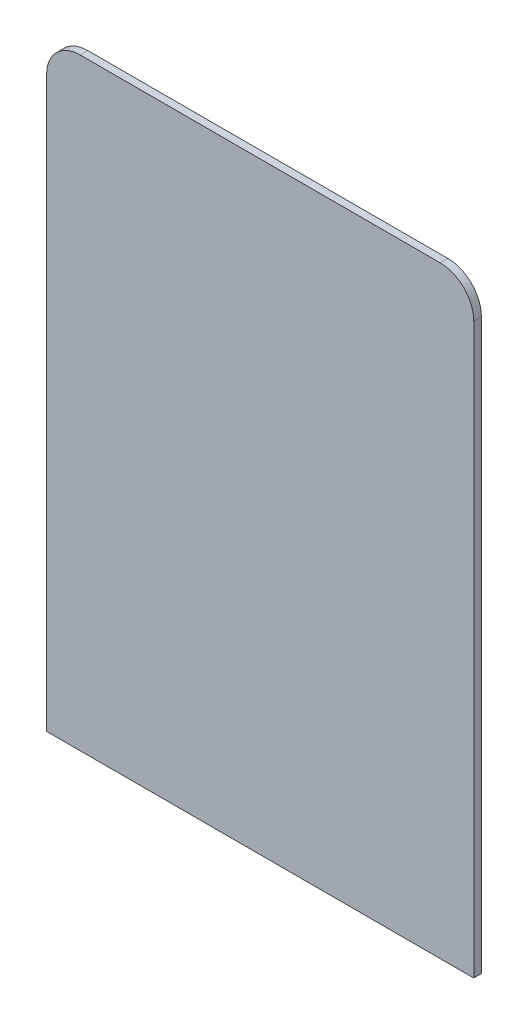
from build123d import *

# Parameters (mm, degrees)
BOSS_EXTRUDE1_DEPTH                 = 3.175
THICKNESS_REDUCTION_FOR_SIDES_DEPTH = 271.192313455


with BuildPart() as part:
    # Sketch2 → Boss-Extrude1 (new body)
    with BuildSketch(Plane.XY):
        with BuildLine():
            Line((-92.075, 0), (92.075, 0))
            Line((92.075, 0), (92.075, 236.855))
            ThreePointArc((92.075, 236.855), (87.053345763, 248.978345763), (74.93, 254))
            Line((74.93, 254), (-74.93, 254))
            ThreePointArc((-74.93, 254), (-87.053345763, 248.978345763), (-92.075, 236.855))
            Line((-92.075, 236.855), (-92.075, 0))
        make_face()
    extrude(amount=BOSS_EXTRUDE1_DEPTH)

    # Sketch4 → Thickness Reduction for sides (cut, through all)
    with BuildSketch(Plane.XY.offset(3.175)):
        with BuildLine():
            ThreePointArc((-74.93, 254), (-87.053345763, 248.978345763), (-92.075, 236.855))
            Line((-92.075, 236.855), (-92.075, 0))
            Line((-92.075, 0), (-88.9, 0))
            Line((-88.9, 0), (-88.9, 236.855))
            ThreePointArc((-88.9, 236.855), (-84.808281733, 246.733281733), (-74.93, 250.825))
            Line((-74.93, 250.825), (74.93, 250.825))
            ThreePointArc((74.93, 250.825), (84.808281733, 246.733281733), (88.9, 236.855))
            Line((88.9, 236.855), (88.9, 0))
            Line((88.9, 0), (92.075, 0))
            Line((92.075, 0), (92.075, 236.855))
            ThreePointArc((92.075, 236.855), (87.053345763, 248.978345763), (74.93, 254))
            Line((74.93, 254), (-74.93, 254))
        make_face()
    extrude(amount=-THICKNESS_REDUCTION_FOR_SIDES_DEPTH, mode=Mode.SUBTRACT)


solid = part.part
